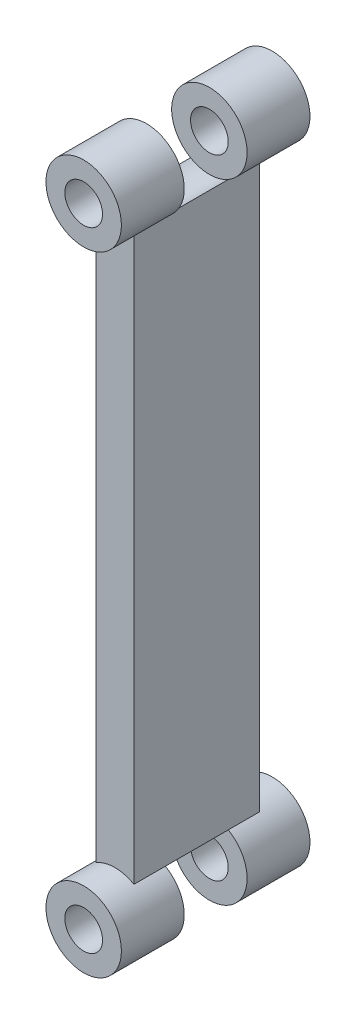
from build123d import *

# Parameters (mm, degrees)
SALIENTE_EXTRUIR1_DEPTH      = 5
SALIENTE_EXTRUIR1_DEPTH_BACK = 5
CROQUIS1_W                   = 3
CROQUIS1_H                   = 50
SALIENTE_EXTRUIR3_DEPTH      = 7.5
SALIENTE_EXTRUIR3_DEPTH_BACK = 7.5
CROQUIS1_4_R                 = 3
CROQUIS1_4_R_2               = 1.5
CORTAR_EXTRUIR1_DEPTH        = 2.5
CORTAR_EXTRUIR1_DEPTH_BACK   = 2.5
CROQUIS1_5_R                 = 3
CORTAR_EXTRUIR2_DEPTH        = 10
CORTAR_EXTRUIR2_DEPTH_BACK   = 10
CROQUIS1_6_R                 = 1.5


with BuildPart() as part:
    # Croquis1 → Saliente-Extruir1 (new, two sides: drawn at the far end of the back side and taken through both)
    with BuildSketch(Plane.XY.offset(-SALIENTE_EXTRUIR1_DEPTH_BACK)):
        Rectangle(CROQUIS1_W, CROQUIS1_H)
    extrude(amount=SALIENTE_EXTRUIR1_DEPTH + SALIENTE_EXTRUIR1_DEPTH_BACK)

    # Croquis1<4> → Saliente-Extruir3 (add, two sides: drawn at the far end of the back side and taken through both)
    # profile 1 of 2: a face of its own
    with BuildSketch(Plane.XY.offset(-SALIENTE_EXTRUIR3_DEPTH_BACK)):
        with Locations((0, 25)):
            Circle(CROQUIS1_4_R)
        with Locations((0, 25)):
            Circle(CROQUIS1_4_R_2, mode=Mode.SUBTRACT)
    # profile 2 of 2: a face of its own
    with BuildSketch(Plane.XY.offset(-SALIENTE_EXTRUIR3_DEPTH_BACK)):
        with Locations((0, -25)):
            Circle(CROQUIS1_4_R)
        with Locations((0, -25)):
            Circle(CROQUIS1_4_R_2, mode=Mode.SUBTRACT)
    extrude(amount=SALIENTE_EXTRUIR3_DEPTH + SALIENTE_EXTRUIR3_DEPTH_BACK)

    # Croquis1<5> → Cortar-Extruir1 (cut, two sides: drawn at the far end of the back side and taken through both)
    with BuildSketch(Plane.XY.offset(-CORTAR_EXTRUIR1_DEPTH_BACK)):
        with Locations((0, 25)):
            Circle(CROQUIS1_5_R)
        with Locations((0, -25)):
            Circle(CROQUIS1_5_R)
    extrude(amount=CORTAR_EXTRUIR1_DEPTH + CORTAR_EXTRUIR1_DEPTH_BACK, mode=Mode.SUBTRACT)

    # Croquis1<6> → Cortar-Extruir2 (cut, two sides: drawn at the far end of the back side and taken through both)
    with BuildSketch(Plane.XY.offset(-CORTAR_EXTRUIR2_DEPTH_BACK)):
        with Locations((0, 25)):
            Circle(CROQUIS1_6_R)
        with Locations((0, -25)):
            Circle(CROQUIS1_6_R)
    extrude(amount=CORTAR_EXTRUIR2_DEPTH + CORTAR_EXTRUIR2_DEPTH_BACK, mode=Mode.SUBTRACT)


solid = part.part
